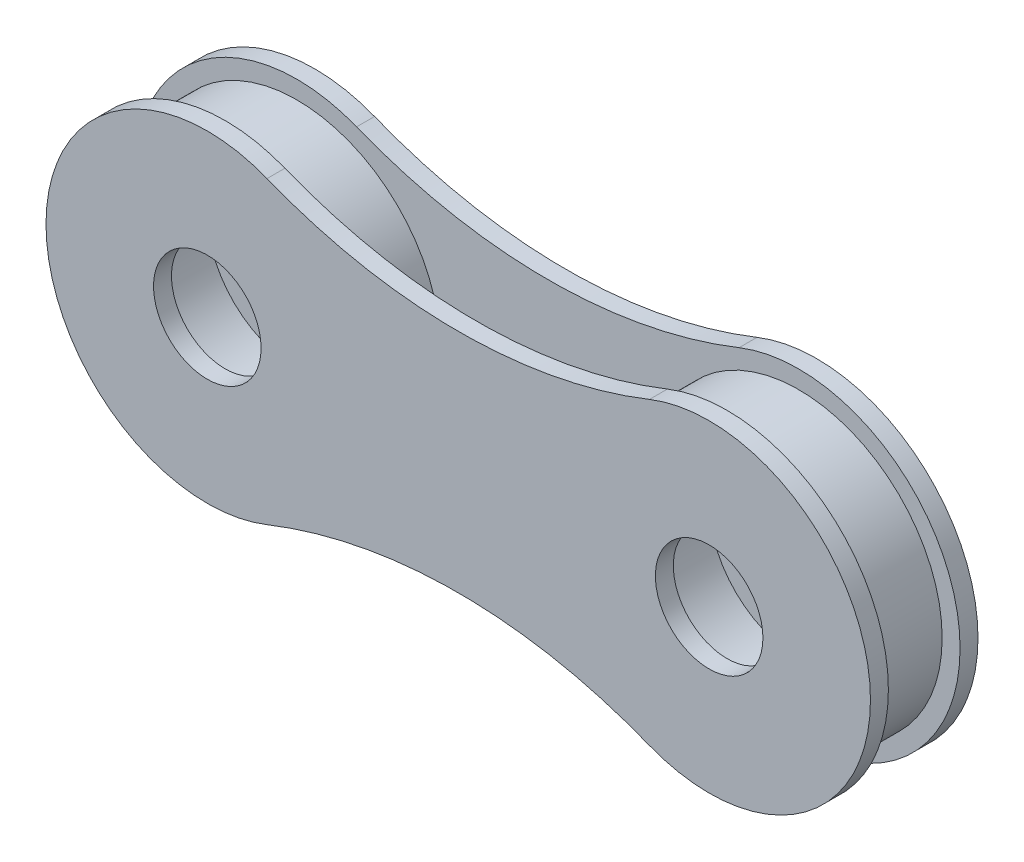
from build123d import *

# Parameters (mm, degrees)
SKETCH1_R               = 4
SKETCH1_R_2             = 2.5
BOSS_EXTRUDE1_DEPTH     = 1
BOSS_EXTRUDE1_2_DEPTH   = 1
BOSS_EXTRUDE2_START     = 1
BOSS_EXTRUDE2_DEPTH     = 0.5
CUT_EXTRUDE1_DEPTH      = 16.67695104
CUT_EXTRUDE1_DEPTH_BACK = 16.67695104
SKETCH4_R               = 1.5


with BuildPart() as part:
    # Sketch1 → Boss-Extrude1 (new, symmetric)
    with BuildSketch(Plane.XY):
        with Locations((-10.442114773, 0)):
            Circle(SKETCH1_R)
        with Locations((-10.442114773, 0)):
            Circle(SKETCH1_R_2, mode=Mode.SUBTRACT)
    extrude(amount=BOSS_EXTRUDE1_DEPTH, both=True)



with BuildPart() as body_2:
    # Sketch1 → Boss-Extrude1 2 (new, symmetric)
    with BuildSketch(Plane.XY):
        with Locations((3.557885227, 0)):
            Circle(SKETCH1_R)
        with Locations((3.557885227, 0)):
            Circle(SKETCH1_R_2, mode=Mode.SUBTRACT)
    extrude(amount=BOSS_EXTRUDE1_2_DEPTH, both=True)


with BuildPart() as part_1:
    add(part.part)

    add(body_2.part)  # Boss-Extrude2 merges body 2
    # Sketch2 → Boss-Extrude2 (add)
    with BuildSketch(Plane.XY.offset(BOSS_EXTRUDE2_START)):
        with BuildLine():
            ThreePointArc((-8.7771853, 4.180670981), (-14.942114773, 0), (-8.7771853, -4.180670981))
            ThreePointArc((-8.7771853, -4.180670981), (-3.442114773, -3.157418725), (1.892955754, -4.180670981))
            ThreePointArc((1.892955754, -4.180670981), (8.057885227, 0), (1.892955754, 4.180670981))
            ThreePointArc((1.892955754, 4.180670981), (-3.442114773, 3.157418725), (-8.7771853, 4.180670981))
        make_face()
    boss_extrude2 = extrude(amount=BOSS_EXTRUDE2_DEPTH)

    # Mirror1: Boss-Extrude2 across plane
    add(boss_extrude2.mirror(Plane.XY))

    # Sketch4 → Cut-Extrude1 (cut, two sides: drawn at the far end of the back side and taken through both)
    with BuildSketch(Plane.XY.offset(-CUT_EXTRUDE1_DEPTH_BACK)):
        with Locations((-10.442114773, 0)):
            Circle(SKETCH4_R)
        with Locations((3.557885227, 0)):
            Circle(SKETCH4_R)
    extrude(amount=CUT_EXTRUDE1_DEPTH + CUT_EXTRUDE1_DEPTH_BACK, mode=Mode.SUBTRACT)


solid = part_1.part
